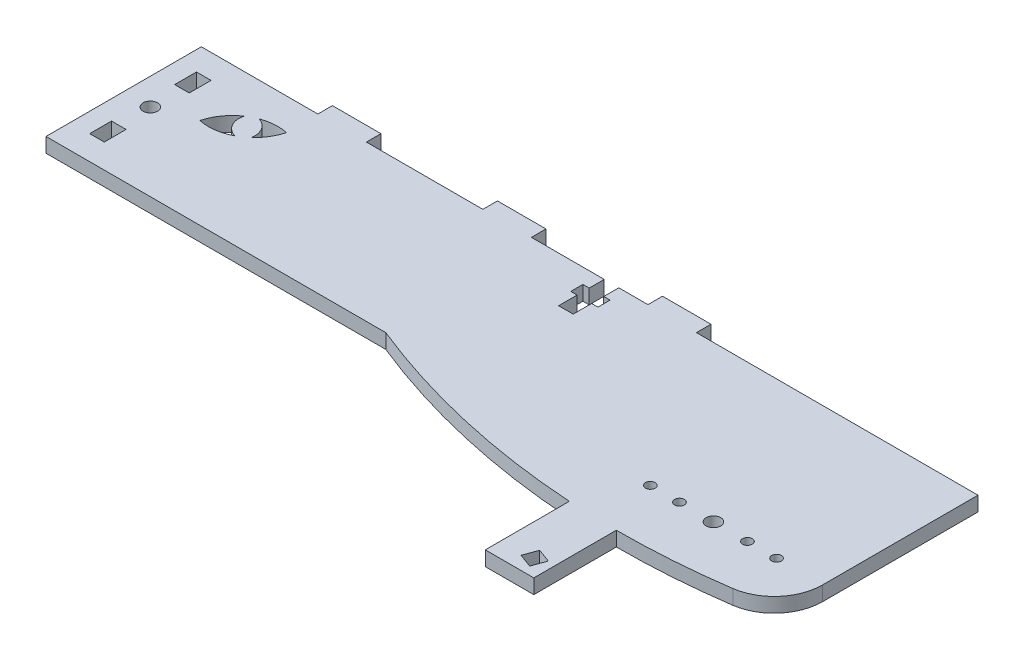
from build123d import *

# Parameters (mm, degrees)
SKETCH2_R           = 1.5
SKETCH2_R_2         = 1
SKETCH2_W           = 3
SKETCH2_H           = 4.5
BOSS_EXTRUDE1_DEPTH = 3


with BuildPart() as part:
    # Sketch2 → Boss-Extrude1 (new body)
    with BuildSketch(Plane(origin=(0, 0, 0), x_dir=(1, 0, 0), z_dir=(0, 1, 0))):
        with BuildLine():
            Line((-90, 8.416796225), (-160, 8.416796225))
            Line((-160, 8.416796225), (-160, 40.416796225))
            Line((-160, 40.416796225), (-136, 40.416796225))
            Line((-136, 40.416796225), (-136, 43.416796225))
            Line((-136, 43.416796225), (-126, 43.416796225))
            Line((-126, 43.416796225), (-126, 40.416796225))
            Line((-126, 40.416796225), (-102, 40.416796225))
            Line((-102, 40.416796225), (-102, 43.416796225))
            Line((-102, 43.416796225), (-92, 43.416796225))
            Line((-92, 43.416796225), (-92, 40.416796225))
            Line((-92, 40.416796225), (-77, 40.416796225))
            Line((-77, 40.416796225), (-77, 37.316796225))
            Line((-77, 37.316796225), (-78.3, 37.316796225))
            Line((-78.3, 37.316796225), (-78.3, 34.816796225))
            Line((-78.3, 34.816796225), (-77, 34.816796225))
            Line((-77, 34.816796225), (-77, 31.016796225))
            Line((-77, 31.016796225), (-74, 31.016796225))
            Line((-74, 31.016796225), (-74, 34.816796225))
            Line((-74, 34.816796225), (-72.7, 34.816796225))
            Line((-72.7, 34.816796225), (-72.7, 37.316796225))
            Line((-72.7, 37.316796225), (-74, 37.316796225))
            Line((-74, 37.316796225), (-74, 40.416796225))
            Line((-74, 40.416796225), (-68, 40.416796225))
            Line((-68, 40.416796225), (-68, 43.416796225))
            Line((-68, 43.416796225), (-58, 43.416796225))
            Line((-58, 43.416796225), (-58, 40.416796225))
            Line((-58, 40.416796225), (0, 40.416796225))
            Line((0, 40.416796225), (0, 8.416796225))
            ThreePointArc((0, 8.416796225), (-2.44071054, 1.870259518), (-8.571428571, -1.480636961))
            ThreePointArc((-8.571428571, -1.480636961), (-19.756847872, -2.687843732), (-31, -3.090935939))
            Line((-31, -3.090935939), (-31, -20.090935939))
            Line((-31, -20.090935939), (-41, -20.090935939))
            Line((-41, -20.090935939), (-41, -2.772140939))
            ThreePointArc((-41, -2.772140939), (-65.95065205, 0.848775542), (-90, 8.416796225))
        make_face()
        with Locations(Location((-22.5, 8.416796225, 0), (0, 0, 270))):
            Circle(SKETCH2_R, mode=Mode.SUBTRACT)
        with Locations(Location((-15.5, 8.416796225, 0), (0, 0, 270))):
            Circle(SKETCH2_R_2, mode=Mode.SUBTRACT)
        with Locations(Location((-29.5, 8.416796225, 0), (0, 0, 90))):
            Circle(SKETCH2_R_2, mode=Mode.SUBTRACT)
        with Locations(Location((-9.5, 8.416796225, 0), (0, 0, 270))):
            Circle(SKETCH2_R_2, mode=Mode.SUBTRACT)
        with Locations(Location((-35.5, 8.416796225, 0), (0, 0, 90))):
            Circle(SKETCH2_R_2, mode=Mode.SUBTRACT)
        with Locations(Location((-154.5, 24.416796225, 0), (0, 0, 270))):
            Circle(SKETCH2_R, mode=Mode.SUBTRACT)
        with Locations((-154.5, 33.166796225)):
            Rectangle(SKETCH2_W, SKETCH2_H, mode=Mode.SUBTRACT)
        with Locations((-154.5, 15.666796225)):
            Rectangle(SKETCH2_W, SKETCH2_H, mode=Mode.SUBTRACT)
        Polygon((-32.5, -15.590935939), (-33.52606043, -18.410013802), (-36.345138292, -17.383953372), (-35.319077862, -14.564875509), align=None, mode=Mode.SUBTRACT)
        with BuildLine():
            ThreePointArc((-147, 27.116796225), (-145.581399645, 30.135325114), (-143.198066283, 32.468491571))
            ThreePointArc((-143.198066283, 32.468491571), (-142.855798146, 29.686729967), (-140.641525824, 27.968491571))
            ThreePointArc((-140.641525824, 27.968491571), (-143.745857333, 26.98342376), (-147, 27.116796225))
        make_face(mode=Mode.SUBTRACT)
        with BuildLine():
            ThreePointArc((-141.198066283, 33.500603039), (-139.132957266, 31.923161808), (-138.641525824, 29.371399432))
            ThreePointArc((-138.641525824, 29.371399432), (-136.955030568, 31.428045885), (-135.912116211, 33.874756027))
            ThreePointArc((-135.912116211, 33.874756027), (-138.582002565, 34.067876633), (-141.198066283, 33.500603039))
        make_face(mode=Mode.SUBTRACT)
    extrude(amount=BOSS_EXTRUDE1_DEPTH)


solid = part.part
